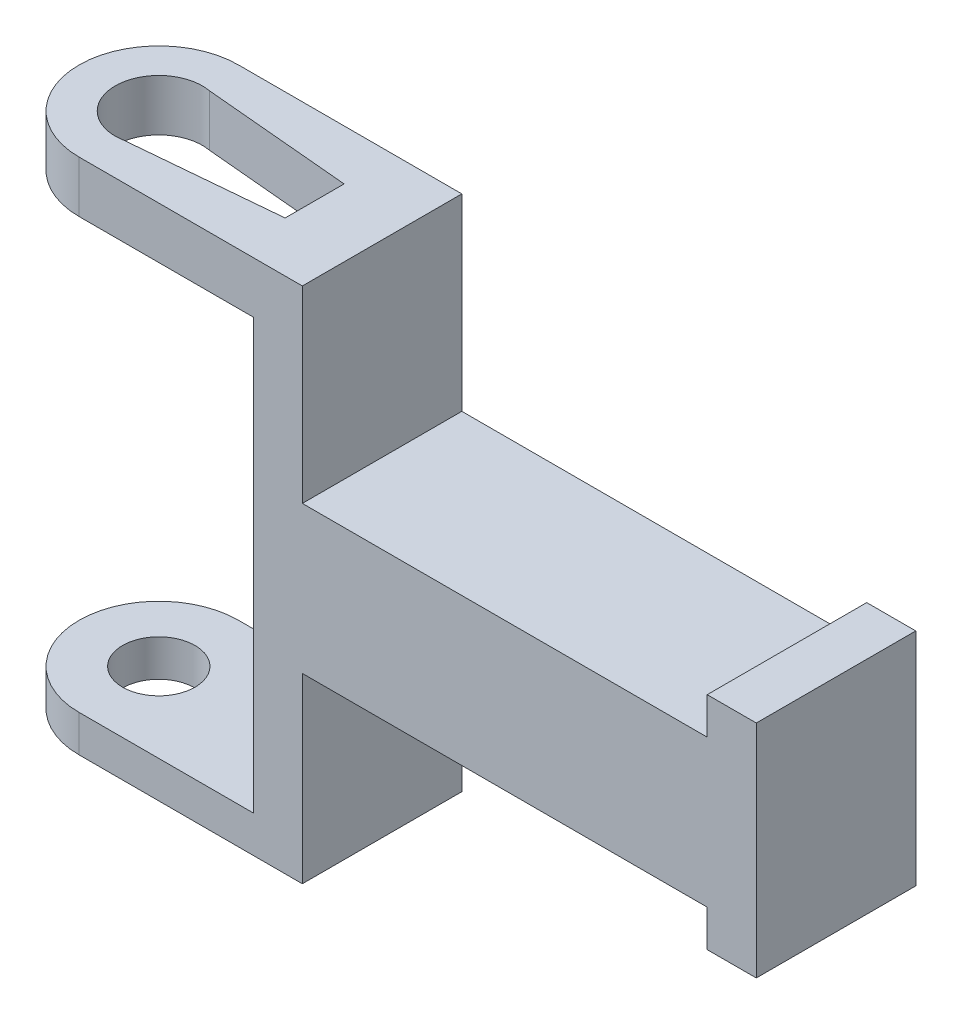
from build123d import *

# Parameters (mm, degrees)
BOSS_EXTRUDE1_START = -3
SKETCH1_W           = 13
SKETCH1_H           = 42.2
BOSS_EXTRUDE1_DEPTH = 2
BOSS_EXTRUDE2_START = 87.25
SKETCH2_R           = 6.5
BOSS_EXTRUDE2_DEPTH = 2.1
BOSS_EXTRUDE3_START = 87.25
SKETCH3_W           = 18.2
SKETCH3_H           = 13
BOSS_EXTRUDE3_DEPTH = 2.1
CUT_EXTRUDE1_START  = 87.25
SKETCH4_R           = 3.55
CUT_EXTRUDE1_DEPTH  = 2.1
CUT_EXTRUDE2_START  = 87.25
CUT_EXTRUDE2_DEPTH  = 2.1
BOSS_EXTRUDE4_START = 48.65
SKETCH6_R           = 6.5
BOSS_EXTRUDE4_DEPTH = 1.5
BOSS_EXTRUDE5_START = 48.65
SKETCH7_W           = 18.2
SKETCH7_H           = 13
BOSS_EXTRUDE5_DEPTH = 1.5
CUT_EXTRUDE3_START  = 48.65
SKETCH8_R           = 2.95
CUT_EXTRUDE3_DEPTH  = 1.5
BOSS_EXTRUDE6_START = 17
SKETCH9_W           = 13
SKETCH9_H           = 12
BOSS_EXTRUDE6_DEPTH = 19
BOSS_EXTRUDE7_START = 34
SKETCH10_W          = 13
SKETCH10_H          = 18
BOSS_EXTRUDE7_DEPTH = 2


with BuildPart() as part:
    # Sketch1 → Boss-Extrude1 (new, symmetric)
    with BuildSketch(Plane(origin=(0, 0, 0), x_dir=(0, 0, -1), z_dir=(1, 0, 0)).offset(BOSS_EXTRUDE1_START)):
        with Locations((0, 68.25)):
            Rectangle(SKETCH1_W, SKETCH1_H)
    extrude(amount=BOSS_EXTRUDE1_DEPTH, both=True)



with BuildPart() as body_2:
    # Sketch2 → Boss-Extrude2 (new, symmetric)
    with BuildSketch(Plane(origin=(0, 0, 0), x_dir=(1, 0, 0), z_dir=(0, 1, 0)).offset(BOSS_EXTRUDE2_START)):
        with Locations(Location((-19.2, 0, 0), (0, 0, 270))):
            Circle(SKETCH2_R)
    extrude(amount=BOSS_EXTRUDE2_DEPTH, both=True)


with BuildPart() as part_1:
    add(part.part)

    add(body_2.part)  # Boss-Extrude3 merges body 2
    # Sketch3 → Boss-Extrude3 (add, symmetric)
    with BuildSketch(Plane(origin=(0, 0, 0), x_dir=(1, 0, 0), z_dir=(0, 1, 0)).offset(BOSS_EXTRUDE3_START)):
        with Locations((-10.1, 0)):
            Rectangle(SKETCH3_W, SKETCH3_H)
    extrude(amount=BOSS_EXTRUDE3_DEPTH, both=True)

    # Sketch4 → Cut-Extrude1 (cut, symmetric)
    with BuildSketch(Plane(origin=(0, 0, 0), x_dir=(1, 0, 0), z_dir=(0, 1, 0)).offset(CUT_EXTRUDE1_START)):
        with Locations(Location((-19.2, 0, 0), (0, 0, 270))):
            Circle(SKETCH4_R)
    extrude(amount=CUT_EXTRUDE1_DEPTH, both=True, mode=Mode.SUBTRACT)

    # Sketch5 → Cut-Extrude2 (cut, symmetric)
    with BuildSketch(Plane(origin=(0, 0, 0), x_dir=(1, 0, 0), z_dir=(0, 1, 0)).offset(CUT_EXTRUDE2_START)):
        Polygon((-19.2, -3.55), (-6.5, -2.403281405), (-6.5, 2.403281405), (-19.2, 3.55), align=None)
    extrude(amount=CUT_EXTRUDE2_DEPTH, both=True, mode=Mode.SUBTRACT)



with BuildPart() as body_2_2:
    # Sketch6 → Boss-Extrude4 (new, symmetric)
    with BuildSketch(Plane(origin=(0, 0, 0), x_dir=(1, 0, 0), z_dir=(0, 1, 0)).offset(BOSS_EXTRUDE4_START)):
        with Locations(Location((-19.2, 0, 0), (0, 0, 270))):
            Circle(SKETCH6_R)
    extrude(amount=BOSS_EXTRUDE4_DEPTH, both=True)


with BuildPart() as part_2:
    add(part_1.part)

    add(body_2_2.part)  # Boss-Extrude5 merges body 2 2
    # Sketch7 → Boss-Extrude5 (add, symmetric)
    with BuildSketch(Plane(origin=(0, 0, 0), x_dir=(1, 0, 0), z_dir=(0, 1, 0)).offset(BOSS_EXTRUDE5_START)):
        with Locations((-10.1, 0)):
            Rectangle(SKETCH7_W, SKETCH7_H)
    extrude(amount=BOSS_EXTRUDE5_DEPTH, both=True)

    # Sketch8 → Cut-Extrude3 (cut, symmetric)
    with BuildSketch(Plane(origin=(0, 0, 0), x_dir=(1, 0, 0), z_dir=(0, 1, 0)).offset(CUT_EXTRUDE3_START)):
        with Locations(Location((-19.2, 0, 0), (0, 0, 270))):
            Circle(SKETCH8_R)
    extrude(amount=CUT_EXTRUDE3_DEPTH, both=True, mode=Mode.SUBTRACT)

    # Sketch9 → Boss-Extrude6 (add, symmetric)
    with BuildSketch(Plane(origin=(0, 0, 0), x_dir=(0, 0, -1), z_dir=(1, 0, 0)).offset(BOSS_EXTRUDE6_START)):
        with Locations((0, 68)):
            Rectangle(SKETCH9_W, SKETCH9_H)
    extrude(amount=BOSS_EXTRUDE6_DEPTH, both=True)

    # Sketch10 → Boss-Extrude7 (add, symmetric)
    with BuildSketch(Plane(origin=(0, 0, 0), x_dir=(0, 0, -1), z_dir=(1, 0, 0)).offset(BOSS_EXTRUDE7_START)):
        with Locations((0, 68)):
            Rectangle(SKETCH10_W, SKETCH10_H)
    extrude(amount=BOSS_EXTRUDE7_DEPTH, both=True)


solid = part_2.part
